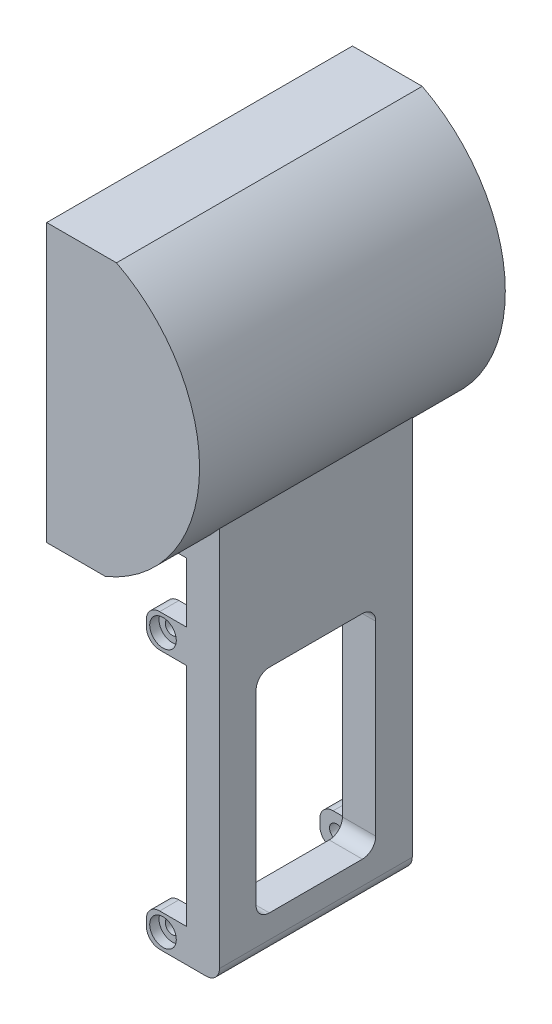
from build123d import *

# Parameters (mm, degrees)
BOSS_EXTRUDE1_DEPTH = 23
BOSS_EXTRUDE2_DEPTH = 2
SKETCH3_R           = 1.05
BOSS_EXTRUDE3_DEPTH = 14.5
SKETCH4_W           = 17
SKETCH4_H           = 23.2
CUT_EXTRUDE1_DEPTH  = 50
SKETCH7_W           = 18
SKETCH7_H           = 32
CUT_EXTRUDE4_DEPTH  = 61.367623773
SKETCH8_R           = 2
CUT_EXTRUDE5_DEPTH  = 1.4
FILLET1_R           = 2


with BuildPart() as part:
    # Sketch1 → Boss-Extrude1 (new, symmetric)
    with BuildSketch(Plane.XY):
        with BuildLine():
            Line((0, 41.7), (16.889174661, 31.949030463))
            ThreePointArc((16.889174661, 31.949030463), (17.524957173, 11.599404984), (0, 1.23661807))
            Line((0, 1.23661807), (0, 0))
            Line((0, 0), (8.83210354, 0))
            ThreePointArc((8.83210354, 0), (22.981624329, 20.31741016), (10.5, 41.7))
            Line((10.5, 41.7), (0, 41.7))
        make_face()
    extrude(amount=BOSS_EXTRUDE1_DEPTH, both=True)

    # Sketch2 → Boss-Extrude2 (add)
    with BuildSketch(Plane.XY.offset(23)):
        with BuildLine():
            Line((0, 41.7), (16.889174661, 31.949030463))
            ThreePointArc((16.889174661, 31.949030463), (17.524957173, 11.599404984), (0, 1.23661807))
            Line((0, 1.23661807), (0, 41.7))
        make_face()
    boss_extrude2 = extrude(amount=-BOSS_EXTRUDE2_DEPTH)

    # Mirror2: Boss-Extrude2 across plane
    add(boss_extrude2.mirror(Plane.XY))

    # Sketch3 → Boss-Extrude3 (add, symmetric)
    with BuildSketch(Plane.XY):
        with BuildLine():
            Line((12.5, -53), (6.5, -53))
            Line((6.5, -53), (6.5, -48))
            Line((6.5, -48), (12.5, -48))
            Line((12.5, -48), (12.5, -14))
            Line((12.5, -14), (6.5, -14))
            Line((6.5, -14), (6.5, -9))
            Line((6.5, -9), (12.5, -9))
            Line((12.5, -9), (12.5, 0))
            Line((12.5, 0), (8.83210354, 0))
            ThreePointArc((8.83210354, 0), (13.539004564, 2.643733533), (17.5, 6.311806514))
            Line((17.5, 6.311806514), (17.5, -53))
            Line((17.5, -53), (12.5, -53))
        make_face()
        with Locations((9, -11.5)):
            Circle(SKETCH3_R, mode=Mode.SUBTRACT)
        with Locations((9, -50.5)):
            Circle(SKETCH3_R, mode=Mode.SUBTRACT)
    extrude(amount=BOSS_EXTRUDE3_DEPTH, both=True)

    # Sketch4 → Cut-Extrude1 (cut)
    with BuildSketch(Plane.XZ.offset(53)):
        with Locations((4, 0)):
            Rectangle(SKETCH4_W, SKETCH4_H)
    extrude(amount=-CUT_EXTRUDE1_DEPTH, mode=Mode.SUBTRACT)

    # Sketch7 → Cut-Extrude4 (cut, through all)
    with BuildSketch(Plane(origin=(17.5, 0, 0), x_dir=(0, 0, -1), z_dir=(1, 0, 0))):
        with Locations((0, -31.5)):
            Rectangle(SKETCH7_W, SKETCH7_H)
    extrude(amount=-CUT_EXTRUDE4_DEPTH, mode=Mode.SUBTRACT)

    # Sketch8 → Cut-Extrude5 (cut)
    with BuildSketch(Plane.XY.offset(14.5)):
        with Locations((9, -11.5)):
            Circle(SKETCH8_R)
        with Locations((9, -50.5)):
            Circle(SKETCH8_R)
    cut_extrude5 = extrude(amount=-CUT_EXTRUDE5_DEPTH, mode=Mode.SUBTRACT)

    # Fillet1
    fillet1_edges = [part.edges().sort_by_distance(p)[0] for p in [
        (15, -47.5, -9),
        (15, -47.5, 9),
        (15, -15.5, 9),
        (15, -15.5, -9),
        (6.5, -48, -13.05),
        (6.5, -53, -13.05),
        (6.5, -48, 13.05),
        (6.5, -53, 13.05),
        (6.5, -14, 13.05),
        (6.5, -14, -13.05),
        (17.5, -53, 0),
        (6.5, -9, 13.05),
        (6.5, -9, -13.05),
    ]]
    fillet(fillet1_edges, radius=FILLET1_R)

    # Mirror3: Cut-Extrude5 across plane
    add(cut_extrude5.mirror(Plane.XY), mode=Mode.SUBTRACT)


solid = part.part
